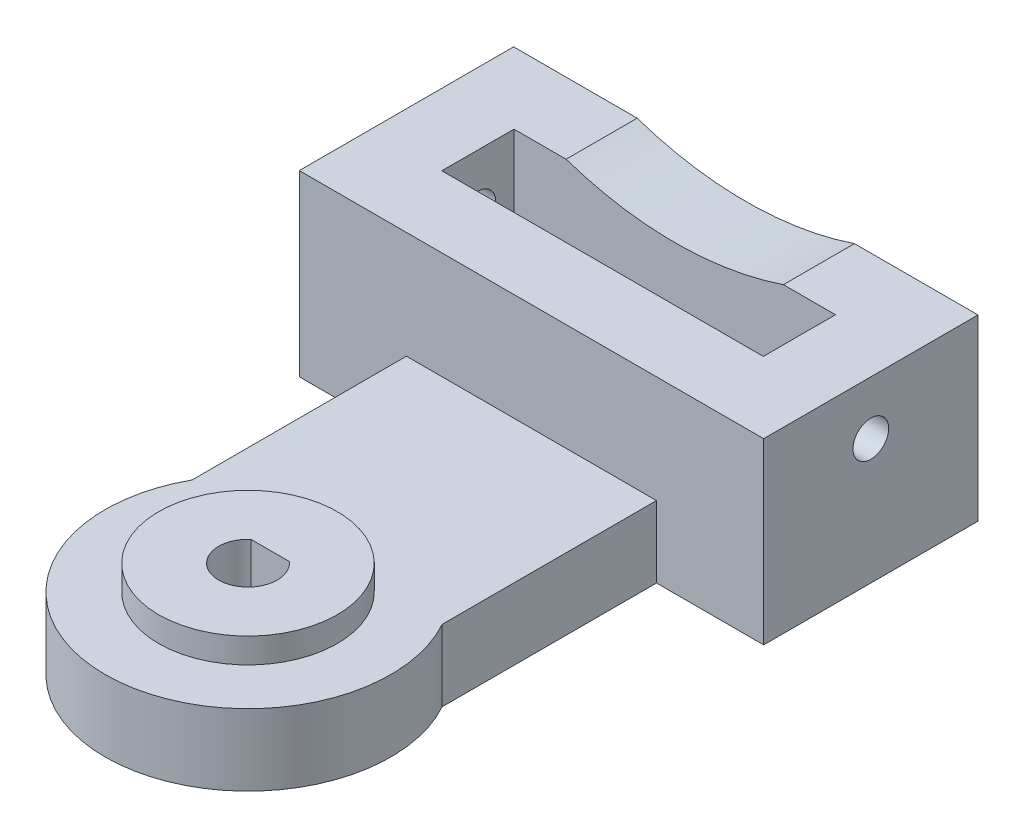
from build123d import *

# Parameters (mm, degrees)
SKETCH1_R                = 20
BOSS_EXTRUDE1_DEPTH      = 10
CUT_EXTRUDE1_DEPTH       = 2.5
BOSS_EXTRUDE2_DEPTH      = 10
BOSS_EXTRUDE3_START      = 6
SKETCH6_R                = 12.5
BOSS_EXTRUDE3_DEPTH      = 6
BOSS_EXTRUDE4_DEPTH      = 10
BOSS_EXTRUDE4_DEPTH_BACK = 20
SKETCH8_R                = 2.5
CUT_EXTRUDE2_DEPTH       = 99.517232015
SKETCH9_R                = 12.5
CUT_EXTRUDE3_DEPTH       = 2.5
SKETCH10_W               = 45
SKETCH10_H               = 15
BOSS_EXTRUDE5_DEPTH      = 9.95
SKETCH11_W               = 45
SKETCH11_H               = 15
BOSS_EXTRUDE6_DEPTH      = 9.95
SKETCH12_R               = 47.5
CUT_EXTRUDE5_DEPTH       = 9.95


with BuildPart() as part:
    # Sketch1 → Boss-Extrude1 (new body)
    with BuildSketch(Plane(origin=(0, 0, 0), x_dir=(1, 0, 0), z_dir=(0, 1, 0))):
        with Locations(Location((0, 0, 0), (0, 0, 270))):
            Circle(SKETCH1_R)
    extrude(amount=BOSS_EXTRUDE1_DEPTH)

    # Sketch2 → Cut-Extrude1 (cut)
    with BuildSketch(Plane(origin=(0, 10, 0), x_dir=(1, 0, 0), z_dir=(0, 1, 0))):
        with BuildLine():
            Line((-2.683281573, 3.1), (2.683281573, 3.1))
            ThreePointArc((2.683281573, 3.1), (0, -4.1), (-2.683281573, 3.1))
        make_face()
    extrude(amount=-CUT_EXTRUDE1_DEPTH, mode=Mode.SUBTRACT)

    # Sketch3 → Boss-Extrude2 (add)
    with BuildSketch(Plane(origin=(0, 0, 0), x_dir=(1, 0, 0), z_dir=(0, 1, 0))):
        with BuildLine():
            Line((-17.5, 59.682458366), (-17.5, 9.682458366))
            ThreePointArc((-17.5, 9.682458366), (0, 20), (17.5, 9.682458366))
            Line((17.5, 9.682458366), (17.5, 59.682458366))
            Line((17.5, 59.682458366), (-17.5, 59.682458366))
        make_face()
    extrude(amount=BOSS_EXTRUDE2_DEPTH)

    # Sketch6 → Boss-Extrude3 (add)
    with BuildSketch(Plane(origin=(0, 10, 0), x_dir=(1, 0, 0), z_dir=(0, 1, 0)).offset(BOSS_EXTRUDE3_START)):
        with Locations(Location((0, 0, 0), (0, 0, 270))):
            Circle(SKETCH6_R)
        with BuildLine():
            Line((-2.683281573, 3.1), (2.683281573, 3.1))
            ThreePointArc((2.683281573, 3.1), (0, -4.1), (-2.683281573, 3.1))
        make_face(mode=Mode.SUBTRACT)
    extrude(amount=-BOSS_EXTRUDE3_DEPTH)

    # Sketch7 → Boss-Extrude4 (add, two sides: drawn at the far end of the back side and taken through both)
    with BuildSketch(Plane(origin=(0, 0, -59.682458366), x_dir=(-1, 0, 0), z_dir=(0, 0, -1)).offset(-BOSS_EXTRUDE4_DEPTH_BACK)):
        Polygon((-32.5, 0), (-32.5, 25), (-22.5, 25), (-22.5, 10), (22.5, 10), (22.5, 25), (32.5, 25), (32.5, 0), align=None)
    extrude(amount=BOSS_EXTRUDE4_DEPTH + BOSS_EXTRUDE4_DEPTH_BACK)

    # Sketch8 → Cut-Extrude2 (cut, through all)
    with BuildSketch(Plane.ZY.offset(32.5)):
        with Locations((-54.682458366, 17.5)):
            Circle(SKETCH8_R)
    extrude(amount=-CUT_EXTRUDE2_DEPTH, mode=Mode.SUBTRACT)

    # Sketch9 → Cut-Extrude3 (cut)
    with BuildSketch(Plane(origin=(0, 16, 0), x_dir=(1, 0, 0), z_dir=(0, 1, 0))):
        with Locations(Location((0, 0, 0), (0, 0, 270))):
            Circle(SKETCH9_R)
    extrude(amount=-CUT_EXTRUDE3_DEPTH, mode=Mode.SUBTRACT)

    # Sketch10 → Boss-Extrude5 (add)
    with BuildSketch(Plane(origin=(0, 0, -69.682458366), x_dir=(-1, 0, 0), z_dir=(0, 0, -1))):
        with Locations((0, 17.5)):
            Rectangle(SKETCH10_W, SKETCH10_H)
    extrude(amount=-BOSS_EXTRUDE5_DEPTH)

    # Sketch11 → Boss-Extrude6 (add)
    with BuildSketch(Plane.XY.offset(-39.682458366)):
        with Locations((0, 17.5)):
            Rectangle(SKETCH11_W, SKETCH11_H)
    extrude(amount=-BOSS_EXTRUDE6_DEPTH)

    # Sketch12 → Cut-Extrude5 (cut)
    with BuildSketch(Plane(origin=(0, 0, -69.682458366), x_dir=(-1, 0, 0), z_dir=(0, 0, -1))):
        with Locations((0, 70)):
            Circle(SKETCH12_R)
    extrude(amount=-CUT_EXTRUDE5_DEPTH, mode=Mode.SUBTRACT)


solid = part.part
